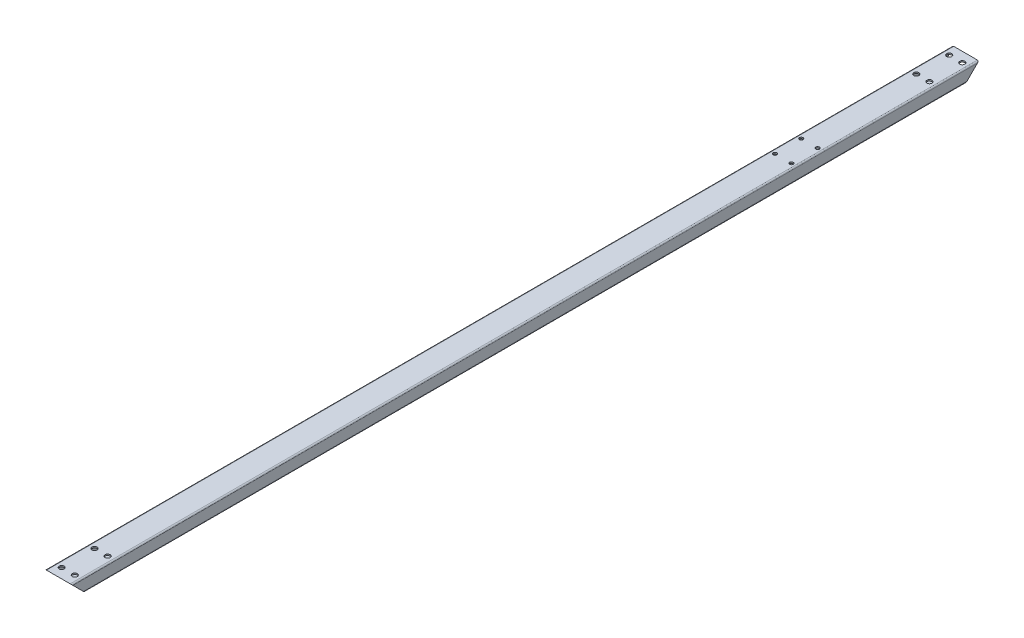
from build123d import *

# Parameters (mm, degrees)
Y_KSEKLIK_EKSTR_ZYON1_DEPTH      = 1380
Y_KSEKLIK_EKSTR_ZYON1_DEPTH_BACK = 1380
IZIM1_W                          = 72
IZIM1_H                          = 32
IZIM2_R                          = 7.75
KES_EKSTR_ZYON1_DEPTH            = 10
IZIM3_R                          = 5.5
KES_EKSTR_ZYON2_DEPTH            = 20
IZIM4_W                          = 72
IZIM4_H                          = 32
Y_KSEKLIK_EKSTR_ZYON2_DEPTH      = 5
IZIM5_W                          = 72
IZIM5_H                          = 32
Y_KSEKLIK_EKSTR_ZYON3_DEPTH      = 5
KES_EKSTR_ZYON3_DEPTH            = 220
KES_EKSTR_ZYON3_DEPTH_BACK       = 290


with BuildPart() as part:
    # Çizim1 → Yükseklik-Ekstrüzyon1 (new, two sides: drawn at the far end of the back side and taken through both)
    with BuildSketch(Plane.XY.offset(-Y_KSEKLIK_EKSTR_ZYON1_DEPTH_BACK)):
        with BuildLine():
            Line((-36, 20), (36, 20))
            ThreePointArc((36, 20), (38.828427125, 18.828427125), (40, 16))
            Line((40, 16), (40, -16))
            ThreePointArc((40, -16), (38.828427125, -18.828427125), (36, -20))
            Line((36, -20), (-36, -20))
            ThreePointArc((-36, -20), (-38.828427125, -18.828427125), (-40, -16))
            Line((-40, -16), (-40, 16))
            ThreePointArc((-40, 16), (-38.828427125, 18.828427125), (-36, 20))
        make_face()
        Rectangle(IZIM1_W, IZIM1_H, mode=Mode.SUBTRACT)
    extrude(amount=Y_KSEKLIK_EKSTR_ZYON1_DEPTH + Y_KSEKLIK_EKSTR_ZYON1_DEPTH_BACK)

    # Çizim2 → Kes-Ekstrüzyon1 (cut)
    with BuildSketch(Plane(origin=(0, 20, 0), x_dir=(1, 0, 0), z_dir=(0, 1, 0))):
        with Locations(Location((-20, 1350, 0), (0, 0, 270))):
            Circle(IZIM2_R)
        with Locations(Location((20, 1350, 0), (0, 0, 270))):
            Circle(IZIM2_R)
        with Locations(Location((20, 1250, 0), (0, 0, 270))):
            Circle(IZIM2_R)
        with Locations(Location((-20, 1250, 0), (0, 0, 270))):
            Circle(IZIM2_R)
        with Locations(Location((-20, -1250, 0), (0, 0, 270))):
            Circle(IZIM2_R)
        with Locations(Location((20, -1250, 0), (0, 0, 270))):
            Circle(IZIM2_R)
        with Locations(Location((20, -1350, 0), (0, 0, 270))):
            Circle(IZIM2_R)
        with Locations(Location((-20, -1350, 0), (0, 0, 270))):
            Circle(IZIM2_R)
    extrude(amount=-KES_EKSTR_ZYON1_DEPTH, mode=Mode.SUBTRACT)

    # Çizim3 → Kes-Ekstrüzyon2 (cut)
    with BuildSketch(Plane(origin=(0, 20, 0), x_dir=(1, 0, 0), z_dir=(0, 1, 0))):
        with Locations(Location((25, 905, 0), (0, 0, 270))):
            Circle(IZIM3_R)
        with Locations(Location((-25, 905, 0), (0, 0, 270))):
            Circle(IZIM3_R)
        with Locations(Location((25, 825, 0), (0, 0, 270))):
            Circle(IZIM3_R)
        with Locations(Location((-25, 825, 0), (0, 0, 270))):
            Circle(IZIM3_R)
    extrude(amount=-KES_EKSTR_ZYON2_DEPTH, mode=Mode.SUBTRACT)


with BuildPart() as body_2:
    # Çizim4 → Yükseklik-Ekstrüzyon2 (new body)
    with BuildSketch(Plane(origin=(0, 0, -1380), x_dir=(-1, 0, 0), z_dir=(0, 0, -1))):
        Rectangle(IZIM4_W, IZIM4_H)
    extrude(amount=-Y_KSEKLIK_EKSTR_ZYON2_DEPTH)


with BuildPart() as body_3:
    # Çizim5 → Yükseklik-Ekstrüzyon3 (new body)
    with BuildSketch(Plane.XY.offset(1380)):
        Rectangle(IZIM5_W, IZIM5_H)
    extrude(amount=-Y_KSEKLIK_EKSTR_ZYON3_DEPTH)


with BuildPart() as kes_ekstr_zyon3_tool:
    # Çizim6 → Kes-Ekstrüzyon3 (new, two sides: drawn at the far end of the back side and taken through both)
    with BuildSketch(Plane(origin=(0, 0, 0), x_dir=(0, 0, -1), z_dir=(1, 0, 0)).offset(-KES_EKSTR_ZYON3_DEPTH_BACK)):
        Polygon((-1380, -20), (-1380, 20), (-1340, -20), align=None)
        Polygon((1380, -20), (1340, -20), (1380, 20), align=None)
    extrude(amount=KES_EKSTR_ZYON3_DEPTH + KES_EKSTR_ZYON3_DEPTH_BACK)


with BuildPart() as part_1:
    add(part.part)

    # Kes-Ekstrüzyon3: cut by kes_ekstr_zyon3_tool
    add(kes_ekstr_zyon3_tool.part, mode=Mode.SUBTRACT)


with BuildPart() as body_2_1:
    add(body_2.part)

    # Kes-Ekstrüzyon3: cut by kes_ekstr_zyon3_tool
    add(kes_ekstr_zyon3_tool.part, mode=Mode.SUBTRACT)


with BuildPart() as body_3_1:
    add(body_3.part)

    # Kes-Ekstrüzyon3: cut by kes_ekstr_zyon3_tool
    add(kes_ekstr_zyon3_tool.part, mode=Mode.SUBTRACT)


solid = Compound([part_1.part, body_2_1.part, body_3_1.part])
